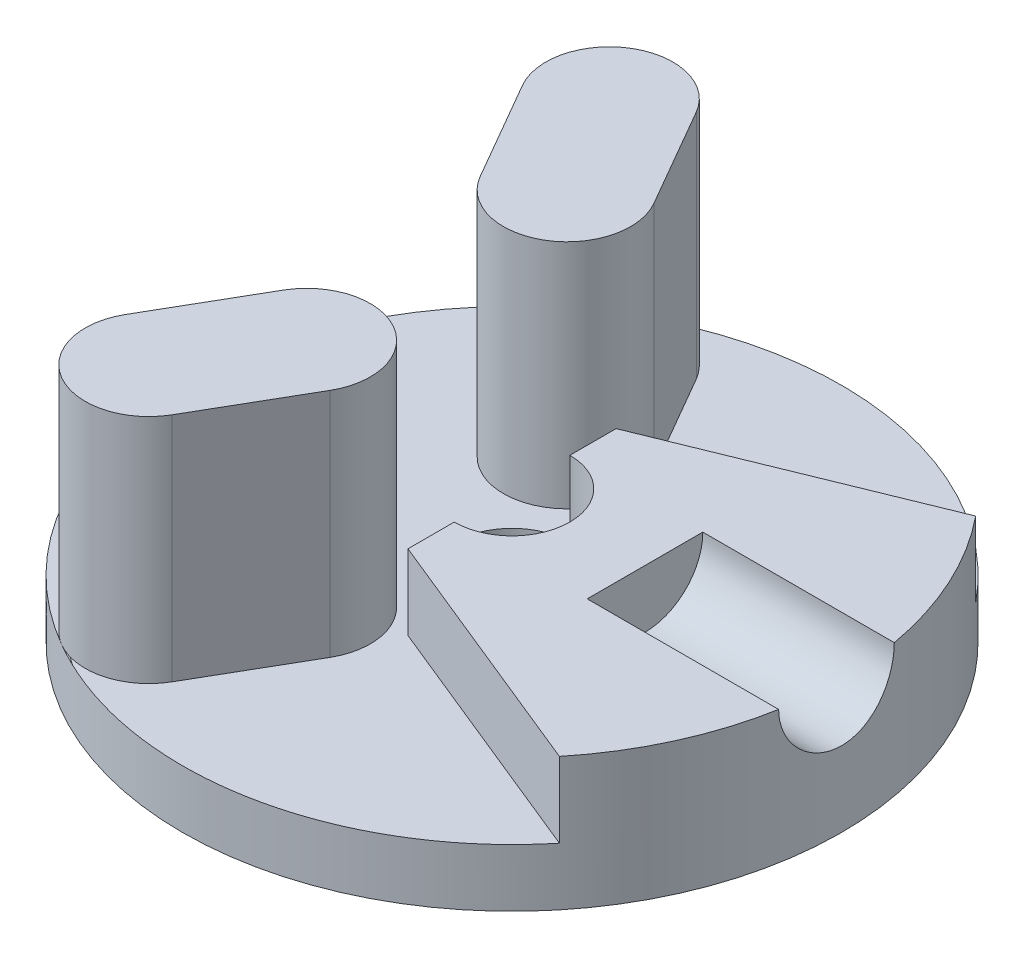
from build123d import *
from build123d.topology import SkipClean

# Parameters (mm, degrees)
SKETCH1_R           = 28.5
SKETCH1_R_2         = 5
BOSS_EXTRUDE1_DEPTH = 5
BOSS_EXTRUDE3_DEPTH = 6.5
SKETCH6_R           = 5
CUT_EXTRUDE1_DEPTH  = 17
BOSS_EXTRUDE4_DEPTH = 20
SKETCH9_R           = 13
CUT_EXTRUDE2_DEPTH  = 4


with BuildPart() as part:
    # Sketch1 → Boss-Extrude1 (new body)
    with BuildSketch(Plane(origin=(0, 0, 0), x_dir=(1, 0, 0), z_dir=(0, 1, 0))):
        with Locations(Location((0, 0, 0), (0, 0, 270))):
            Circle(SKETCH1_R)
        with Locations(Location((0, 0, 0), (0, 0, 270))):
            Circle(SKETCH1_R_2, mode=Mode.SUBTRACT)
    extrude(amount=BOSS_EXTRUDE1_DEPTH)

    # Sketch5 → Boss-Extrude3 (add)
    with SkipClean():  # the faces are left unmerged after this step: merging them gives an invalid solid
        with BuildSketch(Plane(origin=(0, 5, 0), x_dir=(1, 0, 0), z_dir=(0, 1, 0))):
            with BuildLine():
                Line((0, 9), (22.096379794, 18))
                ThreePointArc((22.096379794, 18), (28.5, 0), (22.096379794, -18))
                Line((22.096379794, -18), (0, -9))
                Line((0, -9), (0, -5))
                ThreePointArc((0, -5), (5, 0), (0, 5))
                Line((0, 5), (0, 9))
            make_face()
        extrude(amount=BOSS_EXTRUDE3_DEPTH)

    # Sketch6 → Cut-Extrude1 (cut)
    with SkipClean():  # the faces are left unmerged after this step: merging them gives an invalid solid
        with BuildSketch(Plane(origin=(28.5, 0, 0), x_dir=(0, 0, -1), z_dir=(1, 0, 0))):
            with Locations((0, 11.5)):
                Circle(SKETCH6_R)
        extrude(amount=-CUT_EXTRUDE1_DEPTH, mode=Mode.SUBTRACT)

    # Sketch8 → Boss-Extrude4 (add)
    with SkipClean():  # the faces are left unmerged after this step: merging them gives an invalid solid
        with BuildSketch(Plane(origin=(0, 5, 0), x_dir=(1, 0, 0), z_dir=(0, 1, 0))):
            with BuildLine():
                Line((-6.736860279, 22.668584287), (-1.736860279, 14.008330249))
                ThreePointArc((-1.736860279, 14.008330249), (-3.75, 6.495190528), (-11.263139721, 8.508330249))
                Line((-11.263139721, 8.508330249), (-16.263139721, 17.168584287))
                ThreePointArc((-16.263139721, 17.168584287), (-14.25, 24.681724008), (-6.736860279, 22.668584287))
            make_face()
            with BuildLine():
                Line((-6.736860279, -22.668584287), (-1.736860279, -14.008330249))
                ThreePointArc((-1.736860279, -14.008330249), (-3.75, -6.495190528), (-11.263139721, -8.508330249))
                Line((-11.263139721, -8.508330249), (-16.263139721, -17.168584287))
                ThreePointArc((-16.263139721, -17.168584287), (-14.25, -24.681724008), (-6.736860279, -22.668584287))
            make_face()
        extrude(amount=BOSS_EXTRUDE4_DEPTH)

    # Sketch9 → Cut-Extrude2 (cut)
    with SkipClean():  # the faces are left unmerged after this step: merging them gives an invalid solid
        with BuildSketch(Plane(origin=(0, 0, 0), x_dir=(1, 0, 0), z_dir=(0, 1, 0))):
            with Locations(Location((0, 0, 0), (0, 0, 270))):
                Circle(SKETCH9_R)
        extrude(amount=CUT_EXTRUDE2_DEPTH, mode=Mode.SUBTRACT)


solid = part.part
